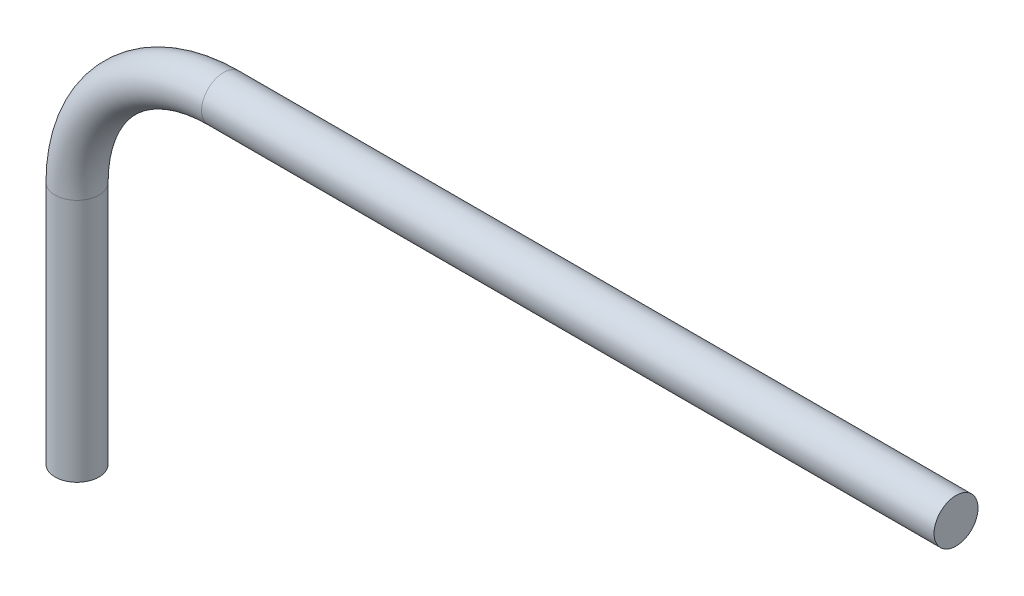
from build123d import *

# Parameters (mm, degrees)
SKETCH1_R = 4.5


with BuildPart() as part:
    # Sweep1: sweep along a path in Sketch2
    with BuildLine(Plane.XY) as sweep1_path:
        Line((0, 0), (0, 50))
        ThreePointArc((0, 50), (8.786796564, 71.213203436), (30, 80))
        Line((30, 80), (180, 80))
    # Sketch1 → Sweep1 (sweep)
    with BuildSketch(Plane(origin=(0, 0, 0), x_dir=(1, 0, 0), z_dir=(0, 1, 0))):
        Circle(SKETCH1_R)
    sweep(path=sweep1_path.line)


solid = part.part
